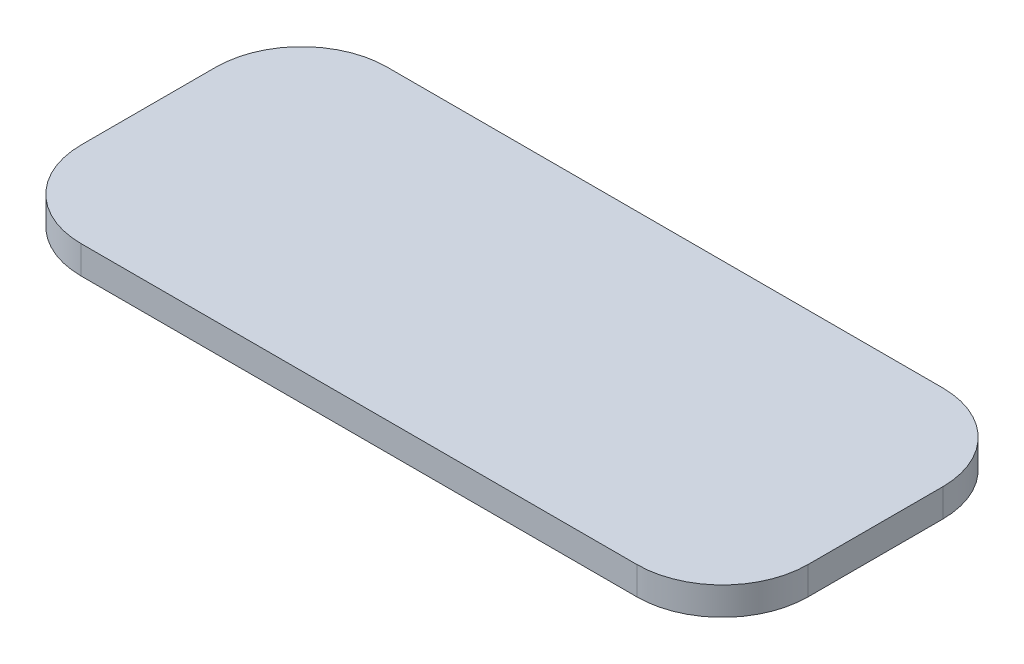
from build123d import *

# Parameters (mm, degrees)
SKETCH_1_W      = 51.8
SKETCH_1_H      = 21.8
EXTRUDE_1_DEPTH = 2
FILLET_1_R      = 6.1


with BuildPart() as part:
    # 草图1 → 凸台-拉伸1 (new body)
    with BuildSketch(Plane(origin=(0, 0, 0), x_dir=(1, 0, 0), z_dir=(0, 1, 0))):
        Rectangle(SKETCH_1_W, SKETCH_1_H)
    extrude(amount=EXTRUDE_1_DEPTH)

    # 圆角1
    fillet_1_edges = [part.edges().sort_by_distance(p)[0] for p in [
        (25.9, 1, 10.9),
        (-25.9, 1, 10.9),
        (-25.9, 1, -10.9),
        (25.9, 1, -10.9),
    ]]
    fillet(fillet_1_edges, radius=FILLET_1_R)


solid = part.part
